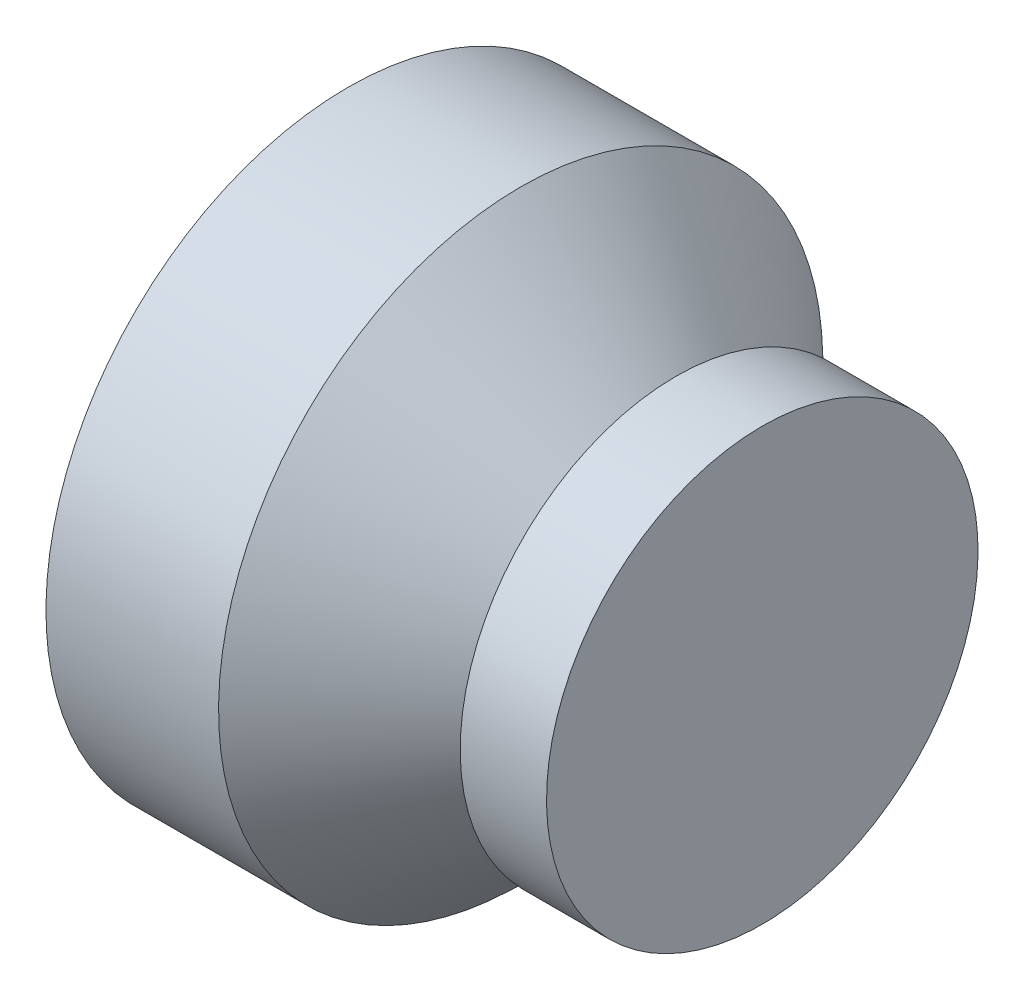
from build123d import *


with BuildPart() as part:
    # Sketch1 → Revolve2 (revolve)
    with BuildSketch(Plane.XY):
        Polygon((-133, 17.5), (-143, 17.5), (-143, 0), (-119, 0), (-119, 12.5), (-124, 12.5), (-124, 9), align=None)
    revolve(axis=Axis((-119, 0, 0), (-1, 0, 0)))


solid = part.part
